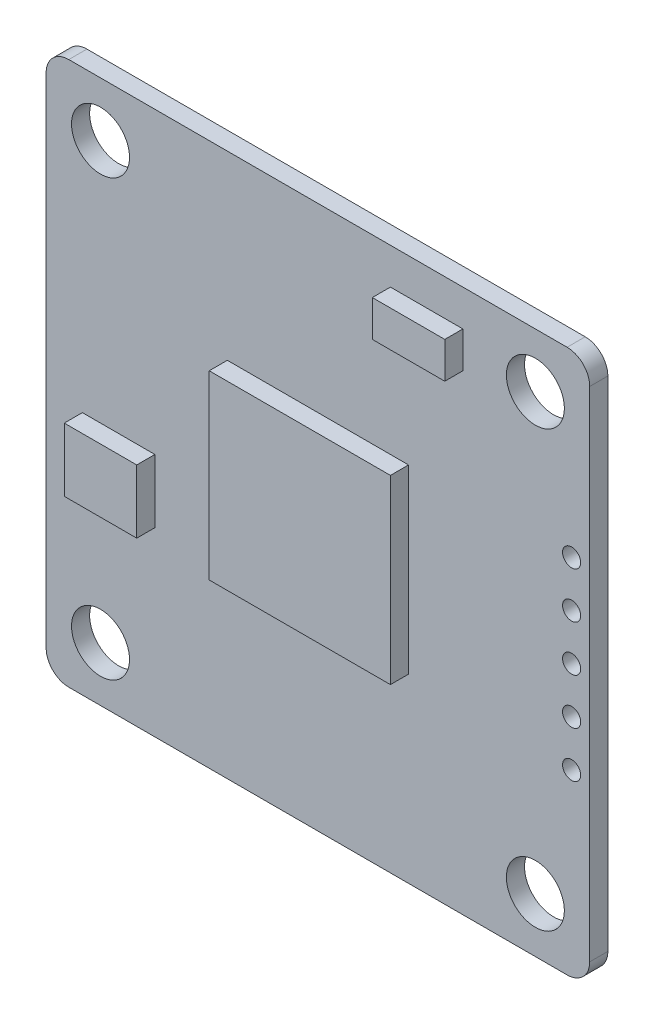
from build123d import *

# Parameters (mm, degrees)
SKETCH_1_W                 = 30
SKETCH_1_H                 = 30
EXTRUDE_1_DEPTH            = 1
FILLET_1_R                 = 1.25
SKETCH_2_R                 = 1.6
CUT_EXTRUDE_1_DEPTH        = 1
SKETCH_3_R                 = 0.5
CUT_EXTRUDE_2_DEPTH        = 1
PATTERN_LINEAR_1_COUNT     = 3
PATTERN_LINEAR_1_PITCH     = 2.54
PATTERN_LINEAR_1_COL_COUNT = 3
PATTERN_LINEAR_1_COL_PITCH = 2.54
SKETCH_4_W                 = 10
SKETCH_4_H                 = 10
EXTRUDE_2_DEPTH            = 1
SKETCH_5_W                 = 4
SKETCH_5_H                 = 3.5
SKETCH_5_H_2               = 2
EXTRUDE_3_DEPTH            = 1


with BuildPart() as part:
    # ｽｹｯﾁ1 → ﾎﾞｽ - 押し出し1 (new body)
    with BuildSketch(Plane.XY):
        Rectangle(SKETCH_1_W, SKETCH_1_H)
    extrude(amount=EXTRUDE_1_DEPTH)

    # ﾌｨﾚｯﾄ1
    fillet_1_edges = [part.edges().sort_by_distance(p)[0] for p in [
        (15, -15, 0.5),
        (-15, -15, 0.5),
        (-15, 15, 0.5),
        (15, 15, 0.5),
    ]]
    fillet(fillet_1_edges, radius=FILLET_1_R)

    # ｽｹｯﾁ2 → ｶｯﾄ - 押し出し1 (cut)
    with BuildSketch(Plane.XY.offset(1)):
        with Locations((-12, 12)):
            Circle(SKETCH_2_R)
        with Locations((12, 12)):
            Circle(SKETCH_2_R)
        with Locations((-12, -12)):
            Circle(SKETCH_2_R)
        with Locations((12, -12)):
            Circle(SKETCH_2_R)
    extrude(amount=-CUT_EXTRUDE_1_DEPTH, mode=Mode.SUBTRACT)

    # ｽｹｯﾁ3 → ｶｯﾄ - 押し出し2 (cut)
    with BuildSketch(Plane.XY.offset(1)):
        with Locations((14, 0)):
            Circle(SKETCH_3_R)
    cut_extrude_2 = extrude(amount=-CUT_EXTRUDE_2_DEPTH, mode=Mode.SUBTRACT)

    # 直線ﾊﾟﾀｰﾝ1: ｶｯﾄ - 押し出し2 ×3
    with Locations(*[(0, -i * PATTERN_LINEAR_1_PITCH, 0) for i in range(1, PATTERN_LINEAR_1_COUNT)]):
        add(cut_extrude_2, mode=Mode.SUBTRACT)

    # 直線ﾊﾟﾀｰﾝ1 col: ｶｯﾄ - 押し出し2 ×3
    with Locations(*[(0, i * PATTERN_LINEAR_1_COL_PITCH, 0) for i in range(1, PATTERN_LINEAR_1_COL_COUNT)]):
        add(cut_extrude_2, mode=Mode.SUBTRACT)

    # ｽｹｯﾁ4 → ﾎﾞｽ - 押し出し2 (add)
    with BuildSketch(Plane.XY.offset(1)):
        Rectangle(SKETCH_4_W, SKETCH_4_H)
    extrude(amount=EXTRUDE_2_DEPTH)

    # ｽｹｯﾁ5 → ﾎﾞｽ - 押し出し3 (add)
    with BuildSketch(Plane.XY.offset(1)):
        with Locations((-11, -3.25)):
            Rectangle(SKETCH_5_W, SKETCH_5_H)
        with Locations((6, 12)):
            Rectangle(SKETCH_5_W, SKETCH_5_H_2)
    extrude(amount=EXTRUDE_3_DEPTH)


solid = part.part
